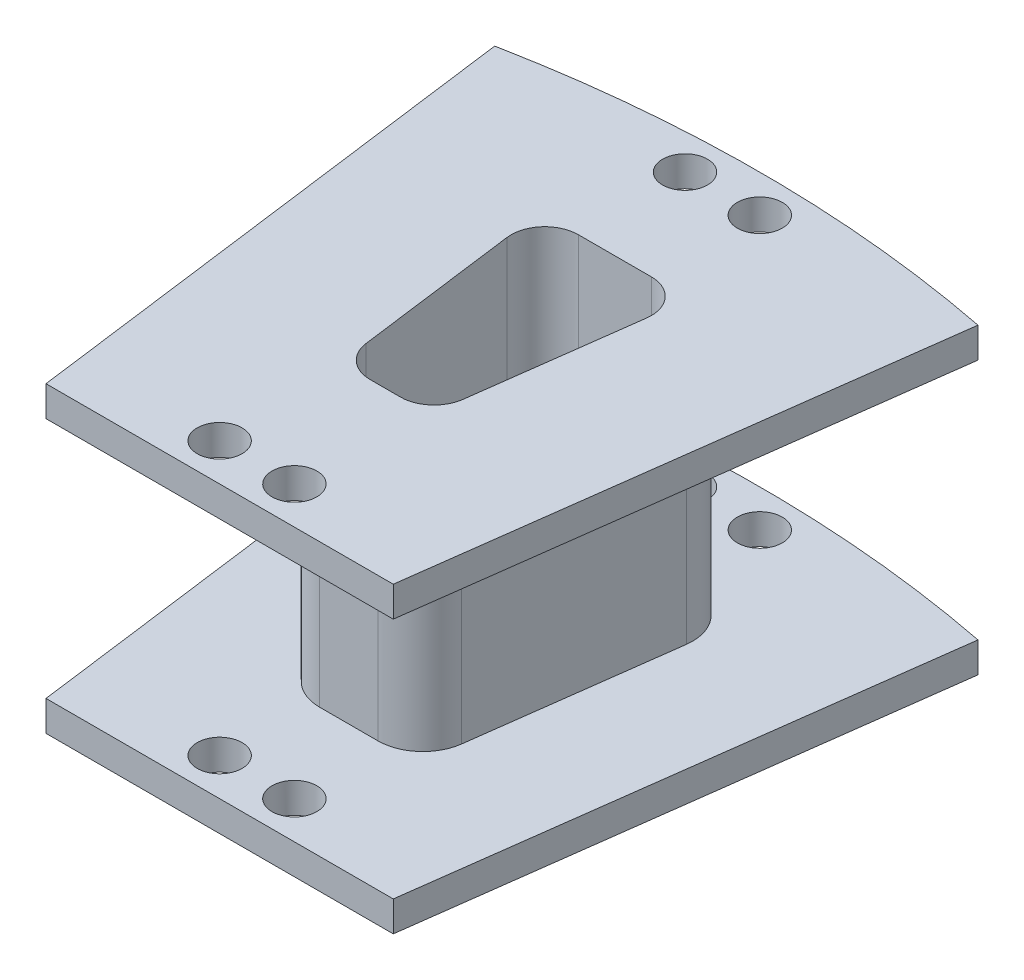
from build123d import *

# Parameters (mm, degrees)
BOSS_EXTRUDE1_DEPTH     = 7.5
BOSS_EXTRUDE2_DEPTH     = 60
SCALE1_SCALE            = 0.27
FILLET1_R               = 3
CUT_EXTRUDE1_DEPTH      = 33.359704853
CUT_EXTRUDE1_DEPTH_BACK = 33.359704853
SKETCH3_R               = 1.5


with BuildPart() as part:
    # Sketch1 → Boss-Extrude1 (new body)
    with BuildSketch(Plane(origin=(0, 0, 0), x_dir=(1, 0, 0), z_dir=(0, 1, 0))):
        with BuildLine():
            Line((-59.846085345, 60.187558837), (-43, -67.771163202))
            Line((-43, -67.771163202), (43, -67.771163202))
            Line((43, -67.771163202), (59.846085345, 60.187558837))
            ThreePointArc((59.846085345, 60.187558837), (0, 66), (-59.846085345, 60.187558837))
        make_face()
    boss_extrude1 = extrude(amount=BOSS_EXTRUDE1_DEPTH)

    # Sketch2 → Boss-Extrude2 (add)
    with BuildSketch(Plane(origin=(0, 7.5, 0), x_dir=(1, 0, 0), z_dir=(0, 1, 0))):
        with BuildLine():
            Line((16.954011105, -35.771163202), (26.24120117, 34.772048928))
            ThreePointArc((26.24120117, 34.772048928), (0, 36), (-26.24120117, 34.772048928))
            Line((-26.24120117, 34.772048928), (-16.954011105, -35.771163202))
            Line((-16.954011105, -35.771163202), (16.954011105, -35.771163202))
        make_face()
    extrude(amount=BOSS_EXTRUDE2_DEPTH)

    # Mirror1: Boss-Extrude1 across plane
    add(boss_extrude1.mirror(Plane.ZX.offset(37.5)))


with BuildPart() as part_1:
    # Scale1: scaled about (0, 37.5, -2.151413181)
    add(part.part.scale(SCALE1_SCALE).moved(Location((0, 27.375, -1.570531622))))

    # Fillet1
    fillet1_edges = [part_1.edges().sort_by_distance(p)[0] for p in [
        (4.577582998, 37.5, 8.087682442),
        (7.085124316, 37.5, -10.958984833),
        (-7.085124316, 37.5, -10.958984833),
        (-4.577582998, 37.5, 8.087682442),
    ]]
    fillet(fillet1_edges, radius=FILLET1_R)

    # Sketch3 → Cut-Extrude1 (cut, two sides: drawn at the far end of the back side and taken through both)
    with BuildSketch(Plane(origin=(0, 47.625, 0), x_dir=(1, 0, 0), z_dir=(0, 1, 0)).offset(-CUT_EXTRUDE1_DEPTH_BACK)):
        with BuildLine():
            ThreePointArc((3.239363531, -3.696003073), (2.492140677, -5.093958707), (1.008612593, -5.65231697))
            Line((1.008612593, -5.65231697), (-1.008612593, -5.65231697))
            ThreePointArc((-1.008612593, -5.65231697), (-2.492140855, -5.093956631), (-3.239363817, -3.696000902))
            Line((-3.239363817, -3.696000902), (-4.667928785, 7.155027331))
            ThreePointArc((-4.667928785, 7.155027331), (-4.128817414, 8.932239348), (-2.437177847, 9.698711264))
            Line((-2.437177847, 9.698711264), (2.437177847, 9.698711264))
            ThreePointArc((2.437177847, 9.698711264), (4.128817414, 8.932239348), (4.667928785, 7.155027331))
            Line((4.667928785, 7.155027331), (3.239363531, -3.696003073))
        make_face()
        with Locations(Location((2.5, 16.890531622, 0), (0, 0, 270))):
            Circle(SKETCH3_R)
        with Locations(Location((-2.5, 16.890531622, 0), (0, 0, 270))):
            Circle(SKETCH3_R)
        with Locations(Location((-2.5, -14.227682443, 0), (0, 0, 270))):
            Circle(SKETCH3_R)
        with Locations(Location((2.5, -14.227682443, 0), (0, 0, 270))):
            Circle(SKETCH3_R)
    extrude(amount=CUT_EXTRUDE1_DEPTH + CUT_EXTRUDE1_DEPTH_BACK, mode=Mode.SUBTRACT)


solid = part_1.part
